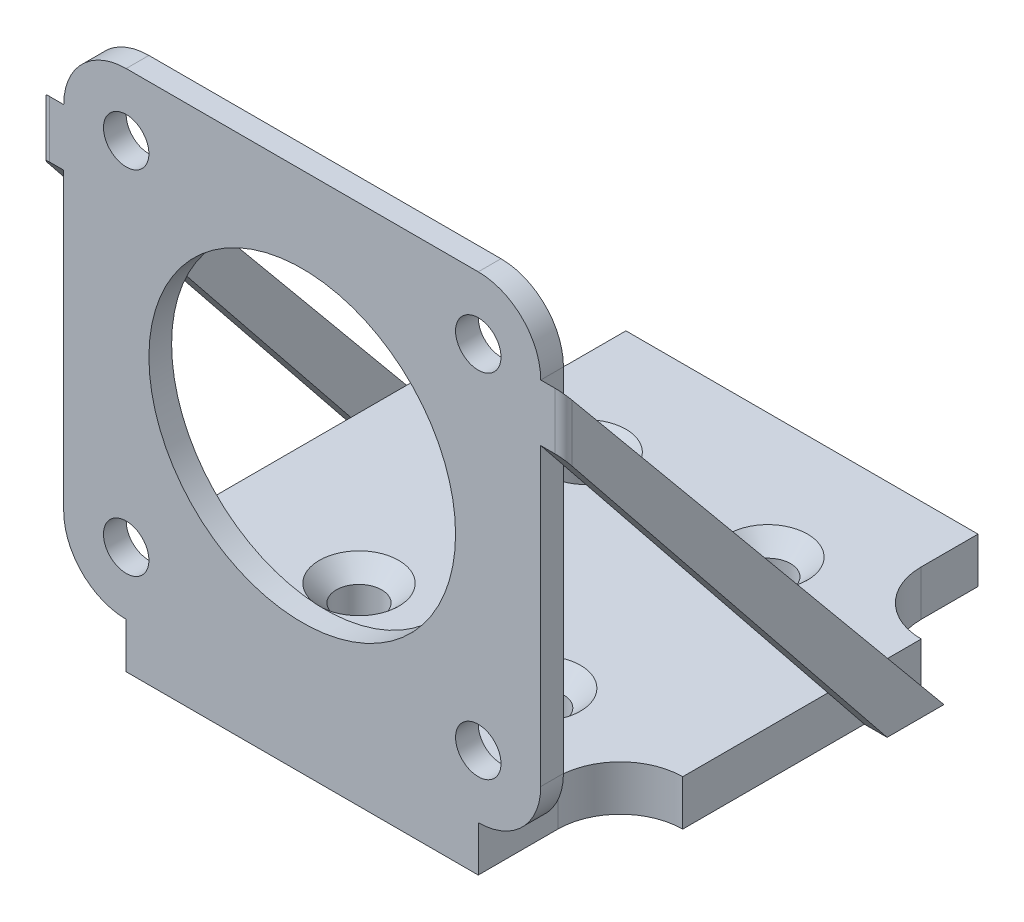
from build123d import *

# Parameters (mm, degrees)
SKETCH1_R           = 2
SKETCH1_R_2         = 13.5
BOSS_EXTRUDE1_DEPTH = 2
SKETCH4_R           = 2
BOSS_EXTRUDE2_DEPTH = 4
CHAMFER1_SIZE       = 1.5
BOSS_EXTRUDE3_DEPTH = 2
FILLET2_R           = 0.75
FILLET4_R           = 0.75


with BuildPart() as part:
    # Sketch1 → Boss-Extrude1 (new body)
    with BuildSketch(Plane.XY):
        with BuildLine():
            Line((-15.5, -21), (15.5, -21))
            ThreePointArc((15.5, -21), (19.389087297, -19.389087297), (21, -15.5))
            Line((21, -15.5), (21, 15.5))
            ThreePointArc((21, 15.5), (19.389087297, 19.389087297), (15.5, 21))
            Line((15.5, 21), (-15.5, 21))
            ThreePointArc((-15.5, 21), (-19.389087297, 19.389087297), (-21, 15.5))
            Line((-21, 15.5), (-21, -15.5))
            ThreePointArc((-21, -15.5), (-19.389087297, -19.389087297), (-15.5, -21))
        make_face()
        with Locations((-15.5, 15.5)):
            Circle(SKETCH1_R, mode=Mode.SUBTRACT)
        with Locations(Location((-15.5, -15.5, 0), (0, 0, 180))):
            Circle(SKETCH1_R, mode=Mode.SUBTRACT)
        with Locations((15.5, -15.5)):
            Circle(SKETCH1_R, mode=Mode.SUBTRACT)
        with Locations(Location((15.5, 15.5, 0), (0, 0, 180))):
            Circle(SKETCH1_R, mode=Mode.SUBTRACT)
        Circle(SKETCH1_R_2, mode=Mode.SUBTRACT)
    extrude(amount=BOSS_EXTRUDE1_DEPTH)



with BuildPart() as body_2:
    # Sketch4 → Boss-Extrude2 (new body)
    with BuildSketch(Plane(origin=(0, -21, 0), x_dir=(1, 0, 0), z_dir=(0, 1, 0))):
        with BuildLine():
            Line((-15.5, 0), (-15.5, 5))
            ThreePointArc((-15.5, 5), (-17.110912703, 8.889087297), (-21, 10.5))
            Line((-21, 10.5), (-21, 31.5))
            ThreePointArc((-21, 31.5), (-17.110912703, 33.110912703), (-15.5, 37))
            Line((-15.5, 37), (-15.5, 42))
            Line((-15.5, 42), (15.5, 42))
            Line((15.5, 42), (15.5, 37))
            ThreePointArc((15.5, 37), (17.110912703, 33.110912703), (21, 31.5))
            Line((21, 31.5), (21, 10.5))
            ThreePointArc((21, 10.5), (17.110912703, 8.889087297), (15.5, 5))
            Line((15.5, 5), (15.5, 0))
            Line((15.5, 0), (15.5, -2))
            Line((15.5, -2), (-15.5, -2))
            Line((-15.5, -2), (-15.5, 0))
        make_face()
        with Locations(Location((-8, 31, 0), (0, 0, 270))):
            Circle(SKETCH4_R, mode=Mode.SUBTRACT)
        with Locations(Location((-8, 11, 0), (0, 0, 90))):
            Circle(SKETCH4_R, mode=Mode.SUBTRACT)
        with Locations(Location((8, 31, 0), (0, 0, 90))):
            Circle(SKETCH4_R, mode=Mode.SUBTRACT)
        with Locations(Location((8, 11, 0), (0, 0, 270))):
            Circle(SKETCH4_R, mode=Mode.SUBTRACT)
    extrude(amount=-BOSS_EXTRUDE2_DEPTH)

    # Chamfer1
    chamfer1_edges = [body_2.edges().sort_by_distance(p)[0] for p in [
        (-8, -21, -33),
        (-8, -21, -9),
        (8, -21, -29),
        (8, -21, -13),
    ]]
    chamfer(chamfer1_edges, length=CHAMFER1_SIZE)


with BuildPart() as part_1:
    add(part.part)

    add(body_2.part)  # Boss-Extrude3 merges body 2
    # Sketch5 → Boss-Extrude3 (add)
    with BuildSketch(Plane.ZY.offset(21)):
        Polygon((-26.5, -25), (2, 10.5), (2, 15.5), (-31.5, -25), align=None)
    boss_extrude3 = extrude(amount=BOSS_EXTRUDE3_DEPTH)

    # Mirror5: Boss-Extrude3 across plane
    add(boss_extrude3.mirror(Plane(origin=(0, 0, 0), x_dir=(0, 0, 1), z_dir=(1, 0, 0))))

    # Fillet2
    fillet2_edges = [part_1.edges().sort_by_distance(p)[0] for p in [
        (23, 13, 2),
    ]]
    fillet(fillet2_edges, radius=FILLET2_R)

    # Fillet4
    fillet4_edges = [part_1.edges().sort_by_distance(p)[0] for p in [
        (-23, 13, 2),
    ]]
    fillet(fillet4_edges, radius=FILLET4_R)


solid = part_1.part
